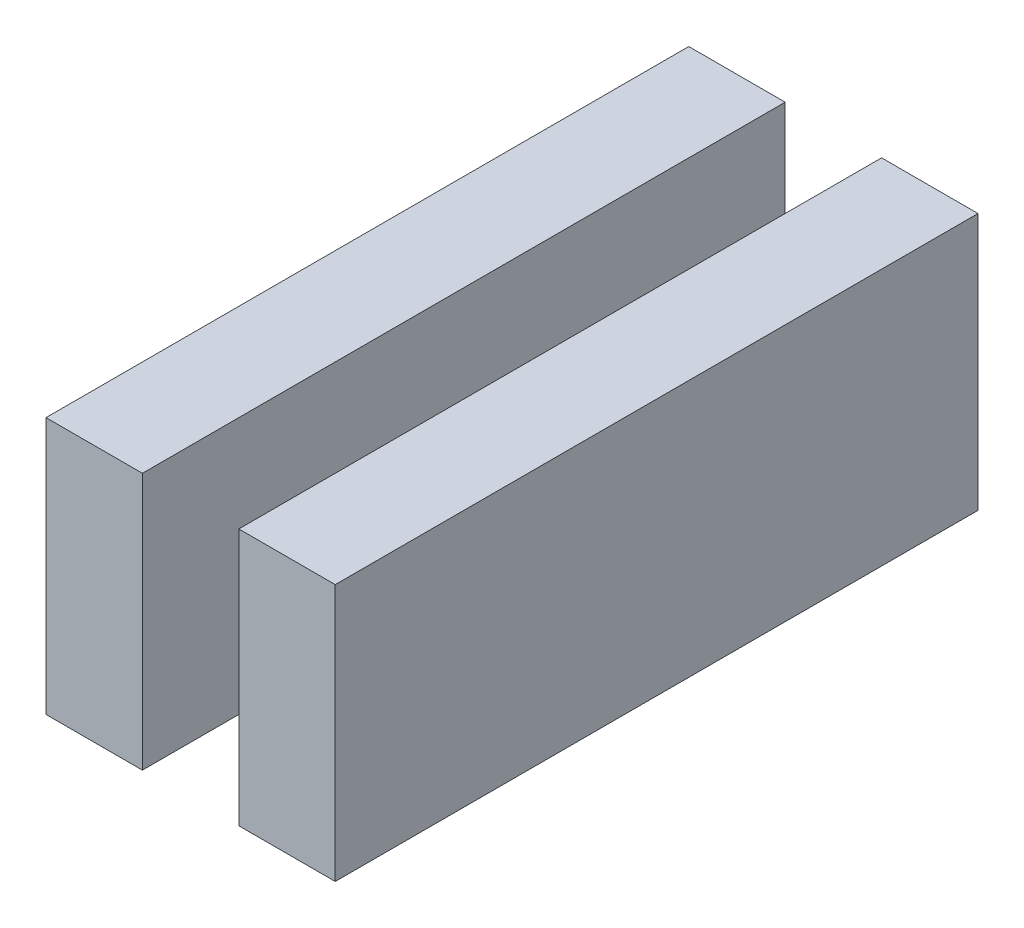
from build123d import *

# Parameters (mm, degrees)
MODEL_W           = 1.5
MODEL_H           = 4
EXTRUDE_1_DEPTH   = 10
EXTRUDE_1_2_DEPTH = 10


with BuildPart() as part:
    # Model → 凸台-拉伸1 (new body)
    with BuildSketch(Plane.XY):
        with Locations((50, 92.5)):
            Rectangle(MODEL_W, MODEL_H)
    extrude(amount=EXTRUDE_1_DEPTH)


with BuildPart() as body_2:
    # Model → Extrude 1 2 (new body)
    with BuildSketch(Plane.XY):
        with Locations((47, 92.5)):
            Rectangle(MODEL_W, MODEL_H)
    extrude(amount=EXTRUDE_1_2_DEPTH)


solid = Compound([part.part, body_2.part])
